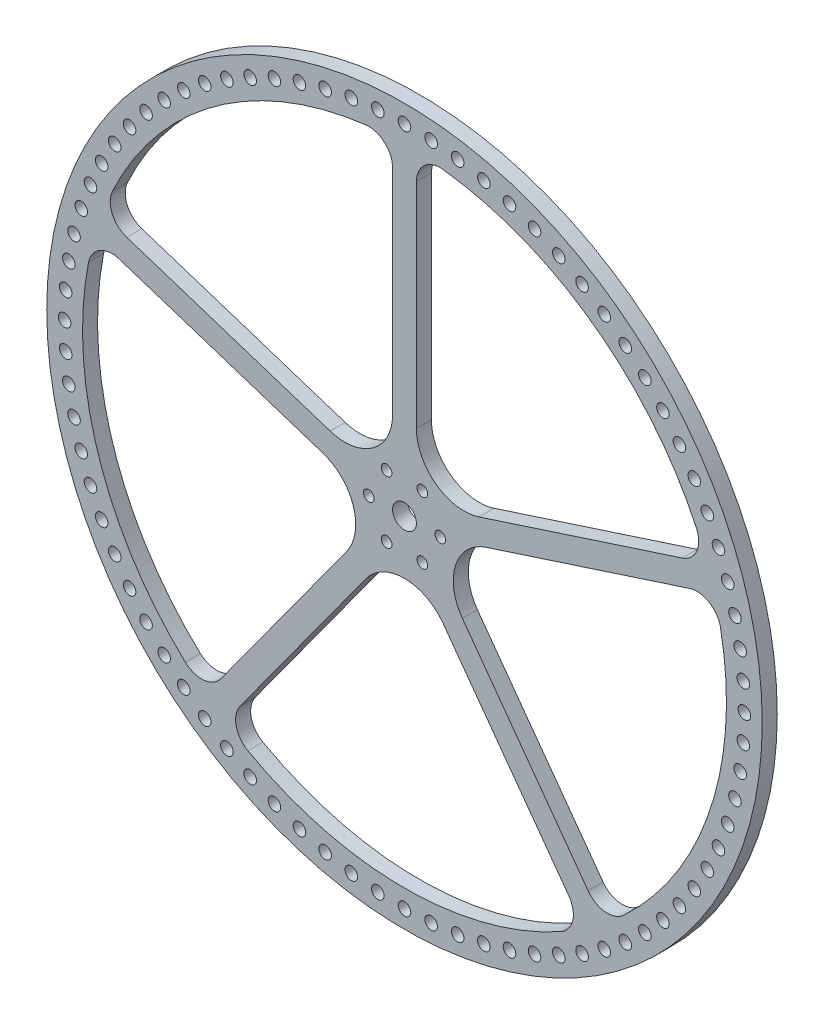
from build123d import *

# Parameters (mm, degrees)
MODEL_R             = 95.25
MODEL_R_2           = 3.175
MODEL_R_3           = 1.6724
MODEL_R_4           = 1.4224
BOSS_EXTRUDE1_DEPTH = 4


with BuildPart() as part:
    # Model → Boss-Extrude1 (new body)
    with BuildSketch(Plane.XY):
        Circle(MODEL_R)
        Circle(MODEL_R_2, mode=Mode.SUBTRACT)
        with Locations((7.099567425, 90.208557236)):
            Circle(MODEL_R_3, mode=Mode.SUBTRACT)
        with Locations((14.155363655, 89.37344872)):
            Circle(MODEL_R_3, mode=Mode.SUBTRACT)
        with Locations((21.123887362, 87.987323172)):
            Circle(MODEL_R_3, mode=Mode.SUBTRACT)
        with Locations((27.962175279, 86.058726518)):
            Circle(MODEL_R_3, mode=Mode.SUBTRACT)
        with Locations((34.628067086, 83.599549198)):
            Circle(MODEL_R_3, mode=Mode.SUBTRACT)
        with Locations((41.080465345, 80.624952857)):
            Circle(MODEL_R_3, mode=Mode.SUBTRACT)
        with Locations((47.279588875, 77.153276872)):
            Circle(MODEL_R_3, mode=Mode.SUBTRACT)
        with Locations((53.187218017, 73.205925279)):
            Circle(MODEL_R_3, mode=Mode.SUBTRACT)
        with Locations((58.766930273, 68.807234812)):
            Circle(MODEL_R_3, mode=Mode.SUBTRACT)
        with Locations((63.984324863, 63.984324863)):
            Circle(MODEL_R_3, mode=Mode.SUBTRACT)
        with Locations((68.807234812, 58.766930273)):
            Circle(MODEL_R_3, mode=Mode.SUBTRACT)
        with Locations((73.205925279, 53.187218017)):
            Circle(MODEL_R_3, mode=Mode.SUBTRACT)
        with Locations((77.153276872, 47.279588875)):
            Circle(MODEL_R_3, mode=Mode.SUBTRACT)
        with Locations((80.624952857, 41.080465345)):
            Circle(MODEL_R_3, mode=Mode.SUBTRACT)
        with Locations((83.599549198, 34.628067086)):
            Circle(MODEL_R_3, mode=Mode.SUBTRACT)
        with Locations((86.058726518, 27.962175279)):
            Circle(MODEL_R_3, mode=Mode.SUBTRACT)
        with Locations((87.987323172, 21.123887362)):
            Circle(MODEL_R_3, mode=Mode.SUBTRACT)
        with Locations((89.37344872, 14.155363655)):
            Circle(MODEL_R_3, mode=Mode.SUBTRACT)
        with Locations((90.208557236, 7.099567425)):
            Circle(MODEL_R_3, mode=Mode.SUBTRACT)
        with Locations((90.4875, 0)):
            Circle(MODEL_R_3, mode=Mode.SUBTRACT)
        with Locations((90.208557236, -7.099567425)):
            Circle(MODEL_R_3, mode=Mode.SUBTRACT)
        with Locations((89.37344872, -14.155363655)):
            Circle(MODEL_R_3, mode=Mode.SUBTRACT)
        with Locations((87.987323172, -21.123887362)):
            Circle(MODEL_R_3, mode=Mode.SUBTRACT)
        with Locations((86.058726518, -27.962175279)):
            Circle(MODEL_R_3, mode=Mode.SUBTRACT)
        with Locations((83.599549198, -34.628067086)):
            Circle(MODEL_R_3, mode=Mode.SUBTRACT)
        with Locations((80.624952857, -41.080465345)):
            Circle(MODEL_R_3, mode=Mode.SUBTRACT)
        with Locations((77.153276872, -47.279588875)):
            Circle(MODEL_R_3, mode=Mode.SUBTRACT)
        with Locations((73.205925279, -53.187218017)):
            Circle(MODEL_R_3, mode=Mode.SUBTRACT)
        with Locations((68.807234812, -58.766930273)):
            Circle(MODEL_R_3, mode=Mode.SUBTRACT)
        with Locations((63.984324863, -63.984324863)):
            Circle(MODEL_R_3, mode=Mode.SUBTRACT)
        with Locations((58.766930273, -68.807234812)):
            Circle(MODEL_R_3, mode=Mode.SUBTRACT)
        with Locations((53.187218017, -73.205925279)):
            Circle(MODEL_R_3, mode=Mode.SUBTRACT)
        with Locations((47.279588875, -77.153276872)):
            Circle(MODEL_R_3, mode=Mode.SUBTRACT)
        with Locations((41.080465345, -80.624952857)):
            Circle(MODEL_R_3, mode=Mode.SUBTRACT)
        with Locations((34.628067086, -83.599549198)):
            Circle(MODEL_R_3, mode=Mode.SUBTRACT)
        with Locations((27.962175279, -86.058726518)):
            Circle(MODEL_R_3, mode=Mode.SUBTRACT)
        with Locations((21.123887362, -87.987323172)):
            Circle(MODEL_R_3, mode=Mode.SUBTRACT)
        with Locations((14.155363655, -89.37344872)):
            Circle(MODEL_R_3, mode=Mode.SUBTRACT)
        with Locations((7.099567425, -90.208557236)):
            Circle(MODEL_R_3, mode=Mode.SUBTRACT)
        with Locations((0, -90.4875)):
            Circle(MODEL_R_3, mode=Mode.SUBTRACT)
        with Locations((-7.099567425, -90.208557236)):
            Circle(MODEL_R_3, mode=Mode.SUBTRACT)
        with Locations((-14.155363655, -89.37344872)):
            Circle(MODEL_R_3, mode=Mode.SUBTRACT)
        with Locations((-21.123887362, -87.987323172)):
            Circle(MODEL_R_3, mode=Mode.SUBTRACT)
        with Locations((-27.962175279, -86.058726518)):
            Circle(MODEL_R_3, mode=Mode.SUBTRACT)
        with Locations((-34.628067086, -83.599549198)):
            Circle(MODEL_R_3, mode=Mode.SUBTRACT)
        with Locations((-41.080465345, -80.624952857)):
            Circle(MODEL_R_3, mode=Mode.SUBTRACT)
        with Locations((-47.279588875, -77.153276872)):
            Circle(MODEL_R_3, mode=Mode.SUBTRACT)
        with Locations((-53.187218017, -73.205925279)):
            Circle(MODEL_R_3, mode=Mode.SUBTRACT)
        with Locations((-58.766930273, -68.807234812)):
            Circle(MODEL_R_3, mode=Mode.SUBTRACT)
        with Locations((-63.984324863, -63.984324863)):
            Circle(MODEL_R_3, mode=Mode.SUBTRACT)
        with Locations((-68.807234812, -58.766930273)):
            Circle(MODEL_R_3, mode=Mode.SUBTRACT)
        with Locations((-73.205925279, -53.187218017)):
            Circle(MODEL_R_3, mode=Mode.SUBTRACT)
        with Locations((-77.153276872, -47.279588875)):
            Circle(MODEL_R_3, mode=Mode.SUBTRACT)
        with Locations((-80.624952857, -41.080465345)):
            Circle(MODEL_R_3, mode=Mode.SUBTRACT)
        with Locations((-83.599549198, -34.628067086)):
            Circle(MODEL_R_3, mode=Mode.SUBTRACT)
        with Locations((-86.058726518, -27.962175279)):
            Circle(MODEL_R_3, mode=Mode.SUBTRACT)
        with Locations((-87.987323172, -21.123887362)):
            Circle(MODEL_R_3, mode=Mode.SUBTRACT)
        with Locations((-89.37344872, -14.155363655)):
            Circle(MODEL_R_3, mode=Mode.SUBTRACT)
        with Locations((-90.208557236, -7.099567425)):
            Circle(MODEL_R_3, mode=Mode.SUBTRACT)
        with Locations((-90.4875, 0)):
            Circle(MODEL_R_3, mode=Mode.SUBTRACT)
        with Locations((-90.208557236, 7.099567425)):
            Circle(MODEL_R_3, mode=Mode.SUBTRACT)
        with Locations((-89.37344872, 14.155363655)):
            Circle(MODEL_R_3, mode=Mode.SUBTRACT)
        with Locations((-87.987323172, 21.123887362)):
            Circle(MODEL_R_3, mode=Mode.SUBTRACT)
        with Locations((-86.058726518, 27.962175279)):
            Circle(MODEL_R_3, mode=Mode.SUBTRACT)
        with Locations((-83.599549198, 34.628067086)):
            Circle(MODEL_R_3, mode=Mode.SUBTRACT)
        with Locations((-80.624952857, 41.080465345)):
            Circle(MODEL_R_3, mode=Mode.SUBTRACT)
        with Locations((-77.153276872, 47.279588875)):
            Circle(MODEL_R_3, mode=Mode.SUBTRACT)
        with Locations((-73.205925279, 53.187218017)):
            Circle(MODEL_R_3, mode=Mode.SUBTRACT)
        with Locations((-68.807234812, 58.766930273)):
            Circle(MODEL_R_3, mode=Mode.SUBTRACT)
        with Locations((-63.984324863, 63.984324863)):
            Circle(MODEL_R_3, mode=Mode.SUBTRACT)
        with Locations((-58.766930273, 68.807234812)):
            Circle(MODEL_R_3, mode=Mode.SUBTRACT)
        with Locations((-53.187218017, 73.205925279)):
            Circle(MODEL_R_3, mode=Mode.SUBTRACT)
        with Locations((-47.279588875, 77.153276872)):
            Circle(MODEL_R_3, mode=Mode.SUBTRACT)
        with Locations((-41.080465345, 80.624952857)):
            Circle(MODEL_R_3, mode=Mode.SUBTRACT)
        with Locations((-34.628067086, 83.599549198)):
            Circle(MODEL_R_3, mode=Mode.SUBTRACT)
        with Locations((-27.962175279, 86.058726518)):
            Circle(MODEL_R_3, mode=Mode.SUBTRACT)
        with Locations((-21.123887362, 87.987323172)):
            Circle(MODEL_R_3, mode=Mode.SUBTRACT)
        with Locations((-14.155363655, 89.37344872)):
            Circle(MODEL_R_3, mode=Mode.SUBTRACT)
        with Locations((-7.099567425, 90.208557236)):
            Circle(MODEL_R_3, mode=Mode.SUBTRACT)
        with Locations((0, 90.4875)):
            Circle(MODEL_R_3, mode=Mode.SUBTRACT)
        with Locations((4.7625, -8.248891971)):
            Circle(MODEL_R_4, mode=Mode.SUBTRACT)
        with Locations((-4.7625, -8.248891971)):
            Circle(MODEL_R_4, mode=Mode.SUBTRACT)
        with Locations((-9.525, 0)):
            Circle(MODEL_R_4, mode=Mode.SUBTRACT)
        with Locations((-4.7625, 8.248891971)):
            Circle(MODEL_R_4, mode=Mode.SUBTRACT)
        with Locations((4.7625, 8.248891971)):
            Circle(MODEL_R_4, mode=Mode.SUBTRACT)
        with Locations((9.525, 0)):
            Circle(MODEL_R_4, mode=Mode.SUBTRACT)
        with BuildLine():
            Line((21.761773743, 3.732436352), (75.925740219, 21.331375886))
            ThreePointArc((75.925740219, 21.331375886), (81.105713587, 20.766544348), (84.119037984, 16.515540368))
            ThreePointArc((84.119037984, 16.515540368), (81.529319859, -26.490481843), (58.346140217, -62.805282793))
            ThreePointArc((58.346140217, -62.805282793), (53.409632124, -64.473229615), (48.886945991, -61.885475975))
            Line((48.886945991, -61.885475975), (15.411773743, -15.810854109))
            ThreePointArc((15.411773743, -15.810854109), (13.607871814, -4.421465576), (21.761773743, 3.732436352))
        make_face(mode=Mode.SUBTRACT)
        with BuildLine():
            Line((10.274515829, -19.543290461), (43.749688076, -65.617912328))
            ThreePointArc((43.749688076, -65.617912328), (44.813201162, -70.718902297), (41.701424575, -74.898376574))
            ThreePointArc((41.701424575, -74.898376574), (0, -85.725), (-41.701424575, -74.898376574))
            ThreePointArc((-41.701424575, -74.898376574), (-44.813201162, -70.718902297), (-43.749688076, -65.617912328))
            Line((-43.749688076, -65.617912328), (-10.274515829, -19.543290461))
            ThreePointArc((-10.274515829, -19.543290461), (0, -14.308163165), (10.274515829, -19.543290461))
        make_face(mode=Mode.SUBTRACT)
        with BuildLine():
            Line((-15.411773743, -15.810854109), (-48.886945991, -61.885475975))
            ThreePointArc((-48.886945991, -61.885475975), (-53.409632124, -64.473229615), (-58.346140217, -62.805282793))
            ThreePointArc((-58.346140217, -62.805282793), (-81.529319859, -26.490481843), (-84.119037984, 16.515540368))
            ThreePointArc((-84.119037984, 16.515540368), (-81.105713587, 20.766544348), (-75.925740219, 21.331375886))
            Line((-75.925740219, 21.331375886), (-21.761773743, 3.732436352))
            ThreePointArc((-21.761773743, 3.732436352), (-13.607871814, -4.421465576), (-15.411773743, -15.810854109))
        make_face(mode=Mode.SUBTRACT)
        with BuildLine():
            Line((-19.799515829, 9.771645231), (-73.963482305, 27.370584765))
            ThreePointArc((-73.963482305, 27.370584765), (-77.822169141, 30.872255031), (-77.761322342, 36.082577135))
            ThreePointArc((-77.761322342, 36.082577135), (-50.387890753, 69.352981843), (-10.287, 85.105541864))
            ThreePointArc((-10.287, 85.105541864), (-5.312886516, 83.553332533), (-3.175, 78.801427652))
            Line((-3.175, 78.801427652), (-3.175, 21.850062987))
            ThreePointArc((-3.175, 21.850062987), (-8.410127296, 11.575547159), (-19.799515829, 9.771645231))
        make_face(mode=Mode.SUBTRACT)
        with BuildLine():
            Line((73.963482305, 27.370584765), (19.799515829, 9.771645231))
            ThreePointArc((19.799515829, 9.771645231), (8.410127296, 11.575547159), (3.175, 21.850062987))
            Line((3.175, 21.850062987), (3.175, 78.801427652))
            ThreePointArc((3.175, 78.801427652), (5.312886516, 83.553332533), (10.287, 85.105541864))
            ThreePointArc((10.287, 85.105541864), (50.387890753, 69.352981843), (77.761322342, 36.082577135))
            ThreePointArc((77.761322342, 36.082577135), (77.822169141, 30.872255031), (73.963482305, 27.370584765))
        make_face(mode=Mode.SUBTRACT)
    extrude(amount=BOSS_EXTRUDE1_DEPTH)


solid = part.part
